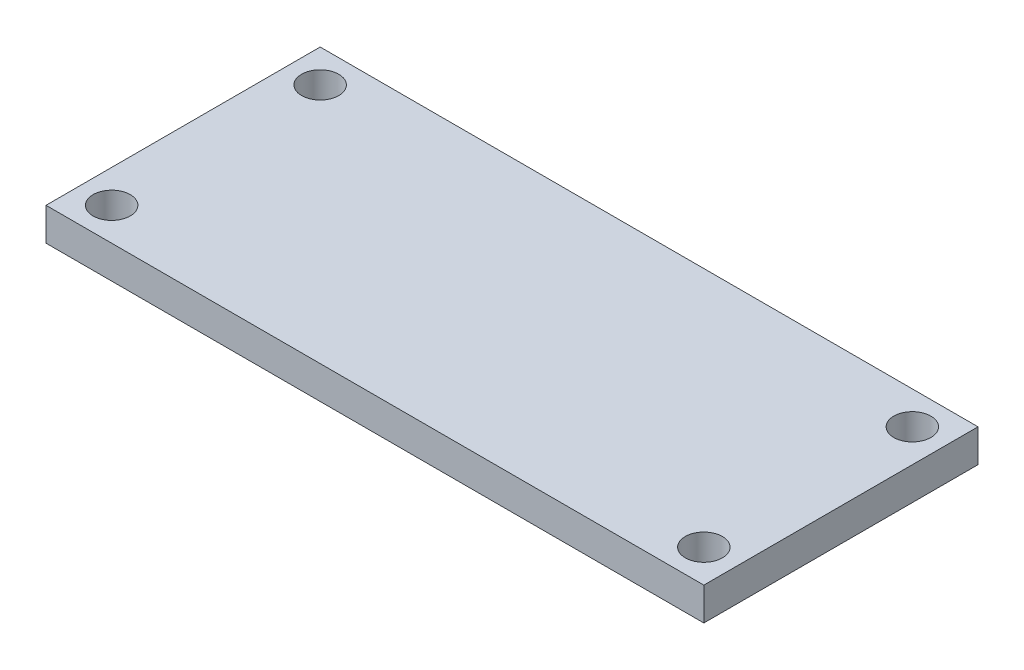
from build123d import *

# Parameters (mm, degrees)
SKETCH1_W           = 40.07
SKETCH1_H           = 16.7
SKETCH1_R           = 1.1303
BOSS_EXTRUDE1_DEPTH = 2


with BuildPart() as part:
    # Sketch1 → Boss-Extrude1 (new body)
    with BuildSketch(Plane(origin=(0, 0, 0), x_dir=(1, 0, 0), z_dir=(0, 1, 0))):
        with Locations((20.035, -8.35)):
            Rectangle(SKETCH1_W, SKETCH1_H)
        with Locations(Location((2, -2, 0), (0, 0, 270))):
            Circle(SKETCH1_R, mode=Mode.SUBTRACT)
        with Locations(Location((38.07, -2, 0), (0, 0, 270))):
            Circle(SKETCH1_R, mode=Mode.SUBTRACT)
        with Locations(Location((38.07, -14.7, 0), (0, 0, 270))):
            Circle(SKETCH1_R, mode=Mode.SUBTRACT)
        with Locations(Location((2, -14.7, 0), (0, 0, 270))):
            Circle(SKETCH1_R, mode=Mode.SUBTRACT)
    extrude(amount=BOSS_EXTRUDE1_DEPTH)


solid = part.part
